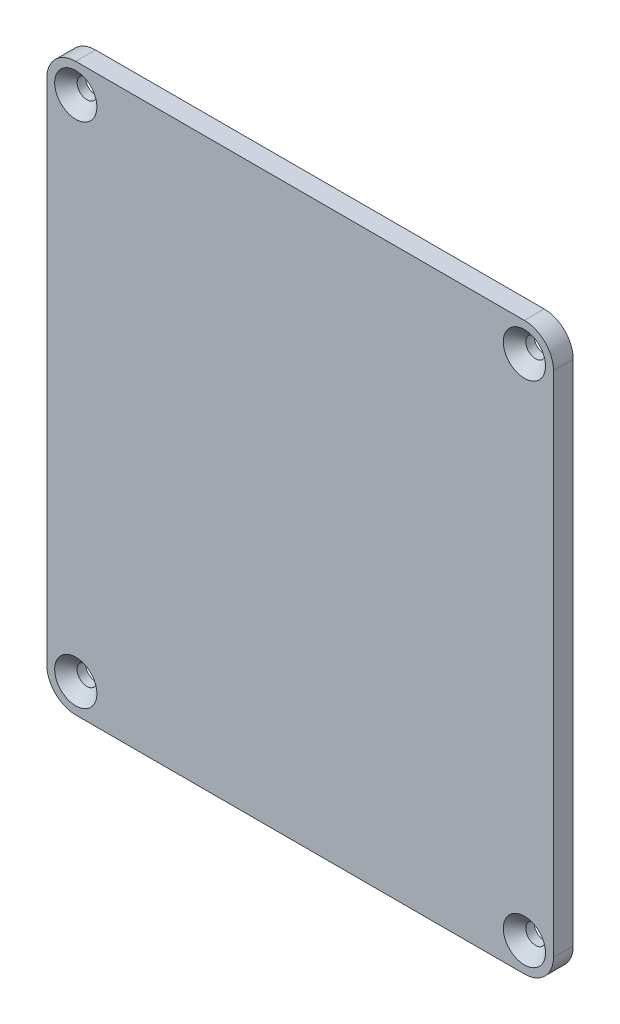
from build123d import *

# Parameters (mm, degrees)
SKETCH_1_R      = 1.5
EXTRUDE_1_DEPTH = 3
CHAMFER_1_SIZE  = 1.7


with BuildPart() as part:
    # Эскиз1 → Бобышка-Вытянуть1 (new body)
    with BuildSketch(Plane.XY):
        with BuildLine():
            Line((38.4, -38.5), (38.4, 38.5))
            ThreePointArc((38.4, 38.5), (37.111269837, 41.611269837), (34, 42.9))
            Line((34, 42.9), (-34, 42.9))
            ThreePointArc((-34, 42.9), (-37.111269837, 41.611269837), (-38.4, 38.5))
            Line((-38.4, 38.5), (-38.4, -38.5))
            ThreePointArc((-38.4, -38.5), (-37.111269837, -41.611269837), (-34, -42.9))
            Line((-34, -42.9), (34, -42.9))
            ThreePointArc((34, -42.9), (37.111269837, -41.611269837), (38.4, -38.5))
        make_face()
        with Locations((34, -38.5)):
            Circle(SKETCH_1_R, mode=Mode.SUBTRACT)
        with Locations(Location((-34, -38.5, 0), (0, 0, 180))):
            Circle(SKETCH_1_R, mode=Mode.SUBTRACT)
        with Locations(Location((34, 38.5, 0), (0, 0, 180))):
            Circle(SKETCH_1_R, mode=Mode.SUBTRACT)
        with Locations((-34, 38.5)):
            Circle(SKETCH_1_R, mode=Mode.SUBTRACT)
    extrude(amount=EXTRUDE_1_DEPTH)

    # Фаска1
    chamfer_1_edges = [part.edges().sort_by_distance(p)[0] for p in [
        (32.5, -38.5, 3),
        (-32.5, -38.5, 3),
        (35.5, 38.5, 3),
        (-35.5, 38.5, 3),
    ]]
    chamfer(chamfer_1_edges, length=CHAMFER_1_SIZE)


solid = part.part
